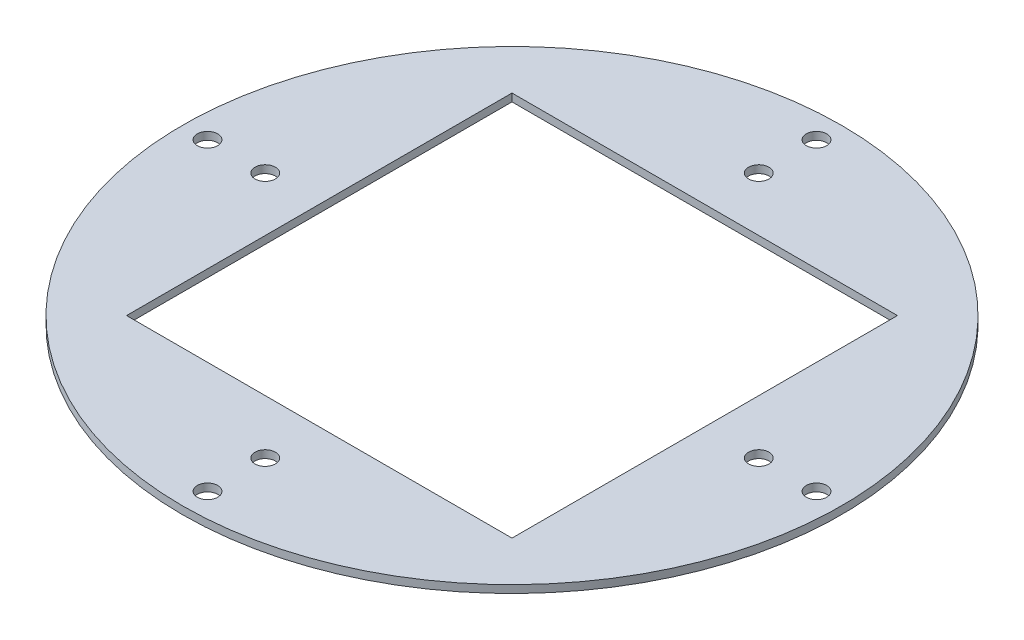
from build123d import *

# Parameters (mm, degrees)
SKETCH_1_R          = 85.5
SKETCH_1_R_2        = 2.65
EXTRUDE_1_DEPTH     = 2
SKETCH_2_W          = 40
SKETCH_2_H          = 100
CUT_EXTRUDE_2_DEPTH = 2
SKETCH_4_R          = 2.65
CUT_EXTRUDE_3_DEPTH = 2
SKETCH_5_W          = 100
SKETCH_5_H          = 100
CUT_EXTRUDE_4_DEPTH = 2


with BuildPart() as part:
    # 草图1 → 凸台-拉伸1 (new body)
    with BuildSketch(Plane(origin=(0, 0, 0), x_dir=(1, 0, 0), z_dir=(0, 1, 0))):
        with Locations(Location((0, 0, 0), (0, 0, 270))):
            Circle(SKETCH_1_R)
        with Locations(Location((0, 79, 0), (0, 0, 270))):
            Circle(SKETCH_1_R_2, mode=Mode.SUBTRACT)
        with Locations(Location((79, 0, 0), (0, 0, 270))):
            Circle(SKETCH_1_R_2, mode=Mode.SUBTRACT)
        with Locations(Location((0, -79, 0), (0, 0, 270))):
            Circle(SKETCH_1_R_2, mode=Mode.SUBTRACT)
        with Locations(Location((-79, 0, 0), (0, 0, 270))):
            Circle(SKETCH_1_R_2, mode=Mode.SUBTRACT)
    extrude(amount=EXTRUDE_1_DEPTH)

    # 草图2 → 切除-拉伸2 (cut)
    with BuildSketch(Plane(origin=(0, 2, 0), x_dir=(1, 0, 0), z_dir=(0, 1, 0))):
        with Locations((-20, 0)):
            Rectangle(SKETCH_2_W, SKETCH_2_H)
        with Locations((20, 0)):
            Rectangle(SKETCH_2_W, SKETCH_2_H)
    extrude(amount=-CUT_EXTRUDE_2_DEPTH, mode=Mode.SUBTRACT)

    # 草图4 → 切除-拉伸3 (cut)
    with BuildSketch(Plane(origin=(0, 2, 0), x_dir=(1, 0, 0), z_dir=(0, 1, 0))):
        with Locations(Location((0, 64.031242374, 0), (0, 0, 270))):
            Circle(SKETCH_4_R)
        with Locations(Location((64.031242374, 0, 0), (0, 0, 270))):
            Circle(SKETCH_4_R)
        with Locations(Location((0, -64.031242374, 0), (0, 0, 270))):
            Circle(SKETCH_4_R)
        with Locations(Location((-64.031242374, 0, 0), (0, 0, 270))):
            Circle(SKETCH_4_R)
    extrude(amount=-CUT_EXTRUDE_3_DEPTH, mode=Mode.SUBTRACT)

    # 草图5 → 切除-拉伸4 (cut)
    with BuildSketch(Plane(origin=(0, 2, 0), x_dir=(1, 0, 0), z_dir=(0, 1, 0))):
        Rectangle(SKETCH_5_W, SKETCH_5_H)
    extrude(amount=-CUT_EXTRUDE_4_DEPTH, mode=Mode.SUBTRACT)


solid = part.part
